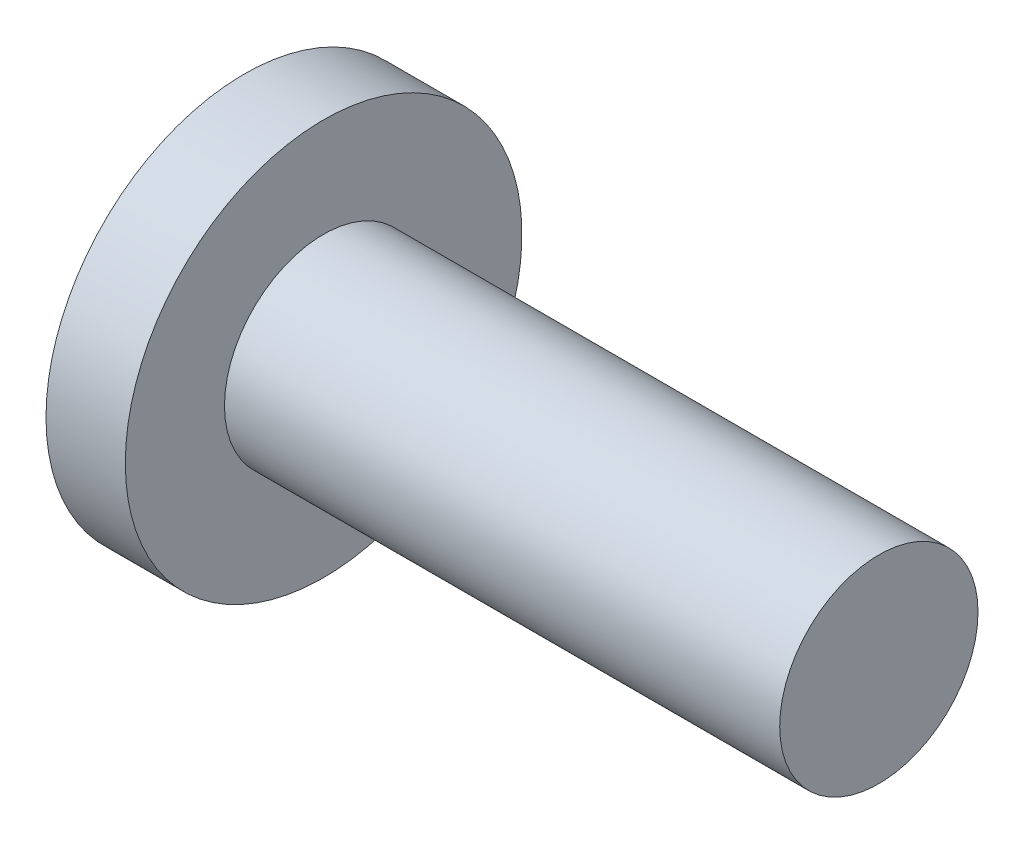
from build123d import *

# Parameters (mm, degrees)
ESCALA1_SCALE = 0.5


with BuildPart() as part:
    # Esboço1 → Revolução1 (revolve)
    with BuildSketch(Plane.XY, mode=Mode.PRIVATE) as revolu_o1_sk:
        Polygon((0, 0), (0, 5), (2, 5), (2, 2.5), (16, 2.5), (16, 0), align=None)
    revolve(revolu_o1_sk.sketch.rotate(Axis((-223.076328801, 0, 0), (1, 0, 0)), 90), axis=Axis((-223.076328801, 0, 0), (1, 0, 0)))


with BuildPart() as part_1:
    # Escala1: scaled about (6.090909091, 0, 0)
    add(part.part.scale(ESCALA1_SCALE).moved(Location((3.045454546, 0, 0))))


solid = part_1.part
